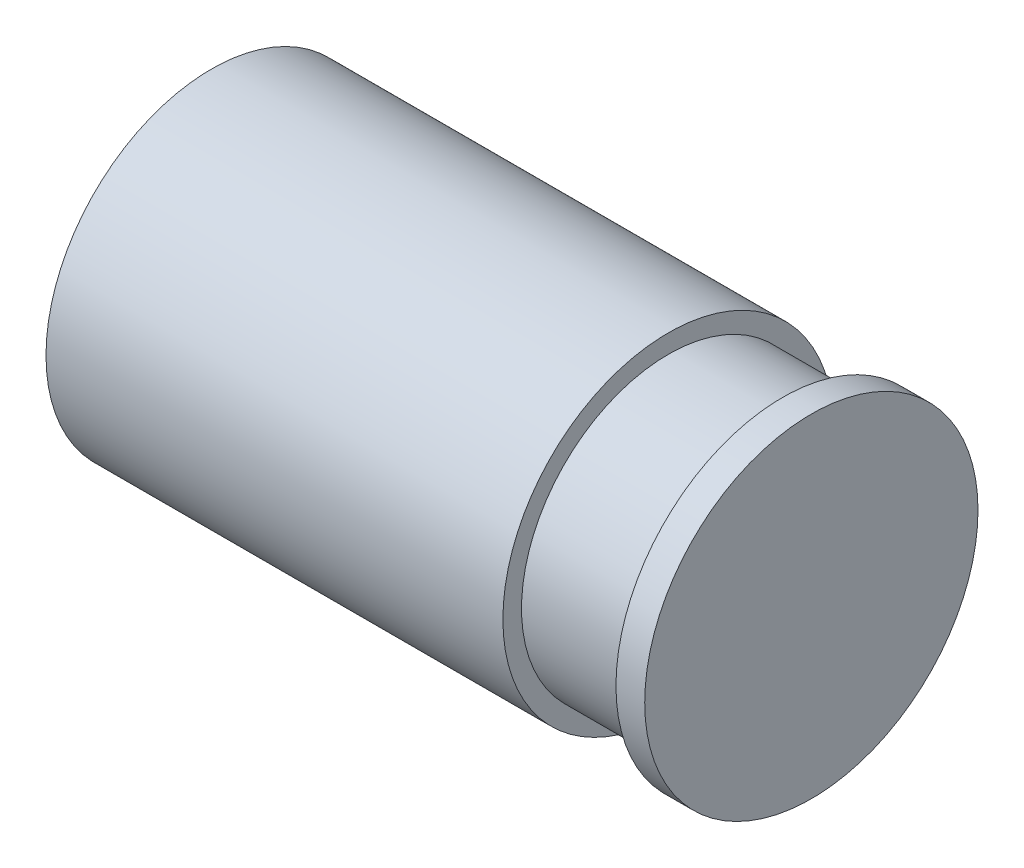
from build123d import *


with BuildPart() as part:
    # Sketch1 → Revolve1 (revolve)
    with BuildSketch(Plane.XY, mode=Mode.PRIVATE) as revolve1_sk:
        Polygon((0, 0), (0, 24.820612545), (68.543963981, 24.820612545), (68.543963981, 22.028059354), (85.684459755, 22.028059354), (85.684459755, 25), (90, 25), (90, 0), align=None)
    revolve(revolve1_sk.sketch.rotate(Axis((0, 0, 0), (-1, 0, 0)), 90), axis=Axis((0, 0, 0), (-1, 0, 0)))


solid = part.part
